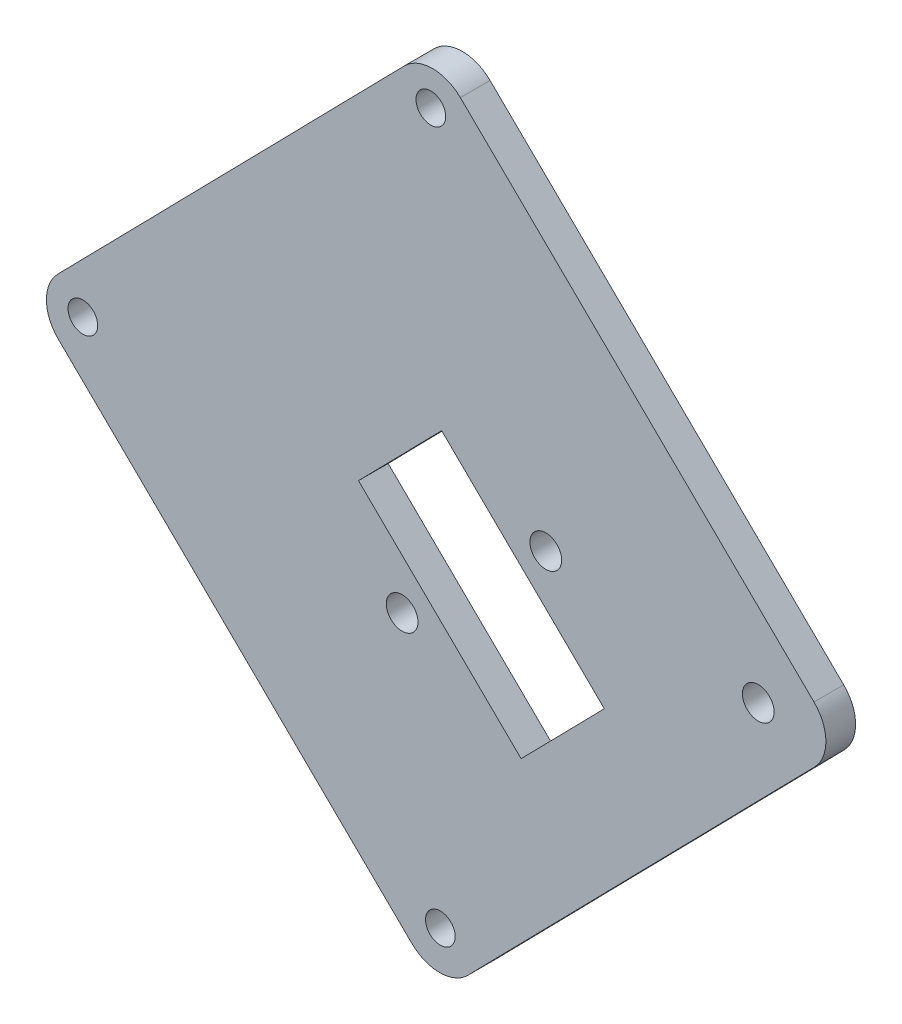
from build123d import *

# Parameters (mm, degrees)
ESQUISSE1_R             = 1.6
BOSS_EXTRU_1_DEPTH      = 3
ESQUISSE2_R             = 1.5
ENL_V_MAT_EXTRU_1_DEPTH = 10


with BuildPart() as part:
    # Esquisse1 → Boss.-Extru.1 (new body)
    with BuildSketch(Plane.XY):
        with BuildLine():
            Line((2.16040571, 38.470971764), (37.868700226, 3.47214746))
            ThreePointArc((37.868700226, 3.47214746), (39.068592938, 0.655617594), (37.925457843, -2.184422046))
            Line((37.925457843, -2.184422046), (2.926633539, -37.892716563))
            ThreePointArc((2.926633539, -37.892716563), (0.110103674, -39.092609274), (-2.729935967, -37.94947418))
            Line((-2.729935967, -37.94947418), (-38.438230483, -2.950649875))
            ThreePointArc((-38.438230483, -2.950649875), (-39.638123195, -0.13412001), (-38.4949881, 2.705919631))
            Line((-38.4949881, 2.705919631), (-3.496163796, 38.414214147))
            ThreePointArc((-3.496163796, 38.414214147), (-0.67963393, 39.614106858), (2.16040571, 38.470971764))
        make_face()
        with Locations((10.790147704, 3.13130948)):
            Circle(ESQUISSE1_R, mode=Mode.SUBTRACT)
        with Locations((-3.720649665, -9.530710886)):
            Circle(ESQUISSE1_R, mode=Mode.SUBTRACT)
        with Locations((32.240509529, 0.58710509)):
            Circle(ESQUISSE1_R, mode=Mode.SUBTRACT)
        Polygon((16.69738986, -7.699410262), (8.297672026, -16.269400946), (-8.128143451, -0.169941765), (0.271574382, 8.400048919), align=None, mode=Mode.SUBTRACT)
    extrude(amount=BOSS_EXTRU_1_DEPTH)

    # Esquisse2 → Enlèv. mat.-Extru.1 (cut)
    with BuildSketch(Plane(origin=(0, 0, 0), x_dir=(-1, 0, 0), z_dir=(0, 0, -1))):
        with Locations((0.820879588, 36.0721308)):
            Circle(ESQUISSE2_R)
        with Locations((35.95969919, 0.221003105)):
            Circle(ESQUISSE2_R)
        with Locations((-0.141386567, -35.162808267)):
            Circle(ESQUISSE2_R)
    extrude(amount=-ENL_V_MAT_EXTRU_1_DEPTH, mode=Mode.SUBTRACT)


solid = part.part
